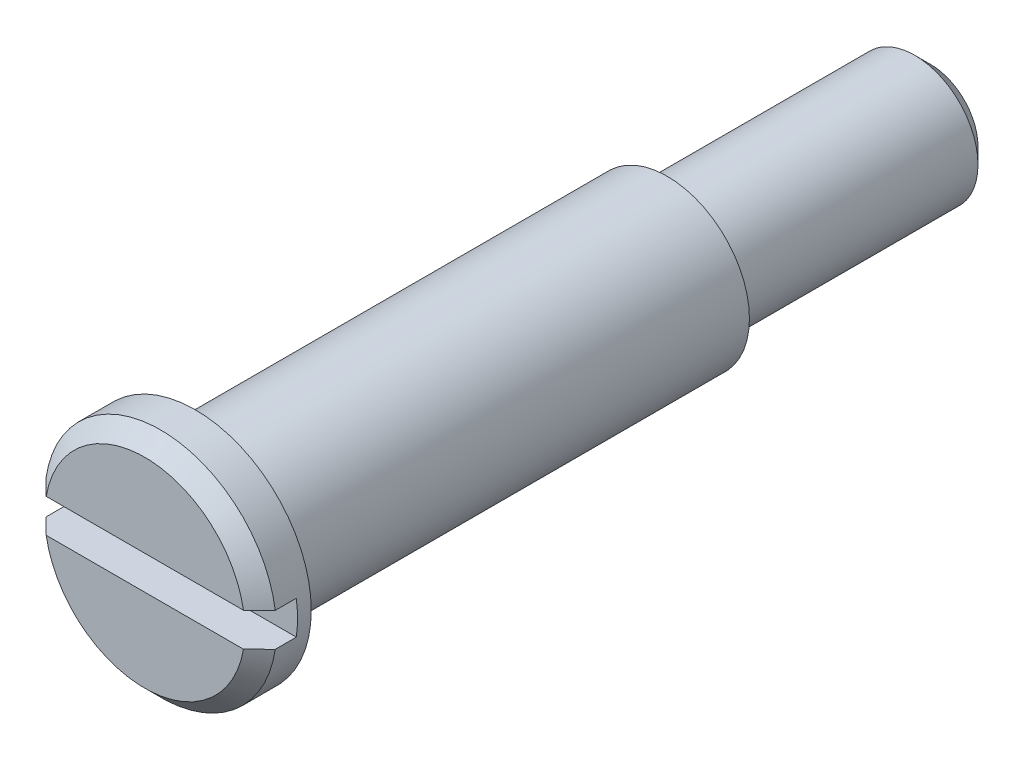
from build123d import *

# Parameters (mm, degrees)
SKETCH1_R          = 3.9
EXTRUDE1_DEPTH     = 22.4
SKETCH2_R          = 3
EXTRUDE2_DEPTH     = 12.5
SKETCH3_R          = 5.5
EXTRUDE3_DEPTH     = 2.4
CHAMFER1_SIZE      = 0.75
SKETCH4_W          = 11
SKETCH4_H          = 1.6
CUT_EXTRUDE1_DEPTH = 1.75
CHAMFER2_SIZE      = 0.75


with BuildPart() as part:
    # Sketch1 → Extrude1 (new body)
    with BuildSketch(Plane.XY):
        Circle(SKETCH1_R)
    extrude(amount=-EXTRUDE1_DEPTH)

    # Sketch2 → Extrude2 (add)
    with BuildSketch(Plane(origin=(0, 0, -22.4), x_dir=(-1, 0, 0), z_dir=(0, 0, -1))):
        with Locations(Location((0, 0, 0), (0, 0, 180))):
            Circle(SKETCH2_R)
    extrude(amount=EXTRUDE2_DEPTH)

    # Sketch3 → Extrude3 (add)
    with BuildSketch(Plane.XY):
        Circle(SKETCH3_R)
    extrude(amount=EXTRUDE3_DEPTH)

    # Chamfer1
    chamfer1_edges = [part.edges().sort_by_distance(p)[0] for p in [
        (-3, 0, -34.9),
    ]]
    chamfer(chamfer1_edges, length=CHAMFER1_SIZE)

    # Sketch4 → Cut-Extrude1 (cut)
    with BuildSketch(Plane.XY.offset(2.4)):
        Rectangle(SKETCH4_W, SKETCH4_H)
    extrude(amount=-CUT_EXTRUDE1_DEPTH, mode=Mode.SUBTRACT)

    # Chamfer2
    chamfer2_edges = [part.edges().sort_by_distance(p)[0] for p in [
        (0, 5.5, 2.4),
        (0, -5.5, 2.4),
    ]]
    chamfer(chamfer2_edges, length=CHAMFER2_SIZE)


solid = part.part
